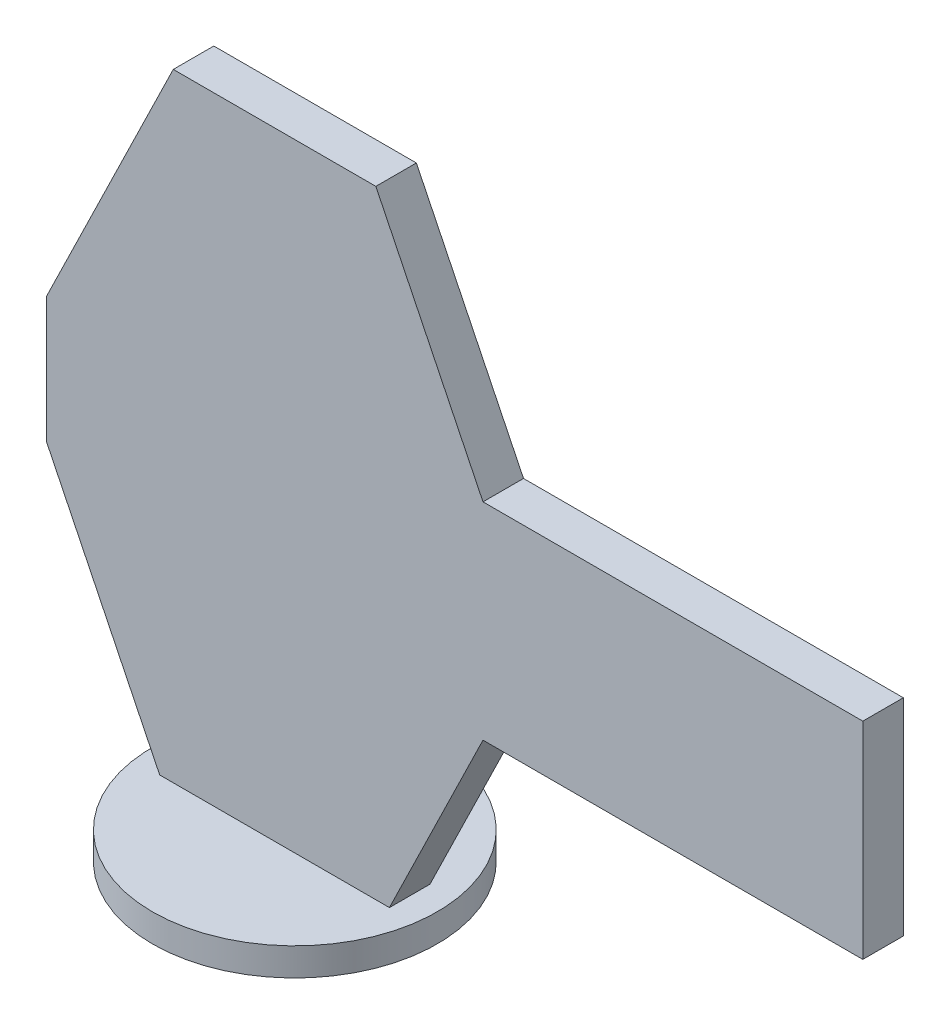
from build123d import *

# Parameters (mm, degrees)
SKETCH1_R                = 11.25
BOSS_EXTRUDE1_DEPTH      = 2.2
BOSS_EXTRUDE2_DEPTH      = 1.6
BOSS_EXTRUDE2_DEPTH_BACK = 1.6
SKETCH3_W                = 33.32922231
SKETCH3_H                = 16.3
BOSS_EXTRUDE3_DEPTH      = 3.2


with BuildPart() as part:
    # Sketch1 → Boss-Extrude1 (new body)
    with BuildSketch(Plane(origin=(0, 0, 0), x_dir=(1, 0, 0), z_dir=(0, 1, 0))):
        Circle(SKETCH1_R)
    extrude(amount=BOSS_EXTRUDE1_DEPTH)

    # Sketch2 → Boss-Extrude2 (add, two sides: drawn at the far end of the back side and taken through both)
    with BuildSketch(Plane.XY.offset(-BOSS_EXTRUDE2_DEPTH_BACK)):
        Polygon((-8, 51), (8, 51), (18, 30.5), (18, 20.5), (8, 0), (-8, 0), (-18, 20.5), (-18, 30.5), align=None)
    extrude(amount=BOSS_EXTRUDE2_DEPTH + BOSS_EXTRUDE2_DEPTH_BACK)

    # Sketch3 → Boss-Extrude3 (add)
    with BuildSketch(Plane.XY.offset(1.6)):
        with Locations((29.798803479, 25.5)):
            Rectangle(SKETCH3_W, SKETCH3_H)
    extrude(amount=-BOSS_EXTRUDE3_DEPTH)


solid = part.part
